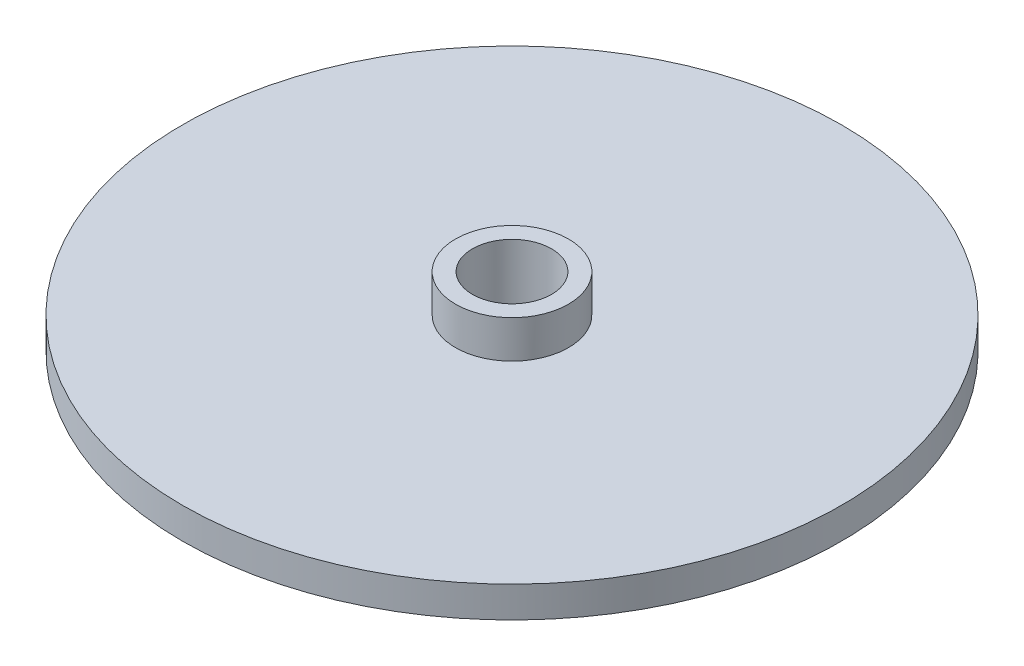
from build123d import *

# Parameters (mm, degrees)
SKETCH_1_R           = 3
SKETCH_1_R_2         = 2.1
EXTRUDE_1_DEPTH      = 3
EXTRUDE_2_DEPTH      = 0.65
EXTRUDE_2_DEPTH_BACK = 1
SKETCH_2_R           = 17.5
SKETCH_2_R_2         = 2.1


with BuildPart() as part:
    # ｽｹｯﾁ1 → ﾎﾞｽ - 押し出し1 (new body)
    with BuildSketch(Plane(origin=(0, 0, 0), x_dir=(1, 0, 0), z_dir=(0, 1, 0))):
        with Locations(Location((0, 0, 0), (0, 0, 270))):
            Circle(SKETCH_1_R)
        with Locations(Location((0, 0, 0), (0, 0, 270))):
            Circle(SKETCH_1_R_2, mode=Mode.SUBTRACT)
    extrude(amount=EXTRUDE_1_DEPTH)

    # ｽｹｯﾁ2 → ﾎﾞｽ - 押し出し2 (add, two sides: drawn at the far end of the back side and taken through both)
    with BuildSketch(Plane.XZ.offset(-EXTRUDE_2_DEPTH_BACK)):
        with Locations(Location((0, 0, 0), (0, 0, 270))):
            Circle(SKETCH_2_R)
        with Locations(Location((0, 0, 0), (0, 0, 270))):
            Circle(SKETCH_2_R_2, mode=Mode.SUBTRACT)
    extrude(amount=EXTRUDE_2_DEPTH + EXTRUDE_2_DEPTH_BACK)


solid = part.part
